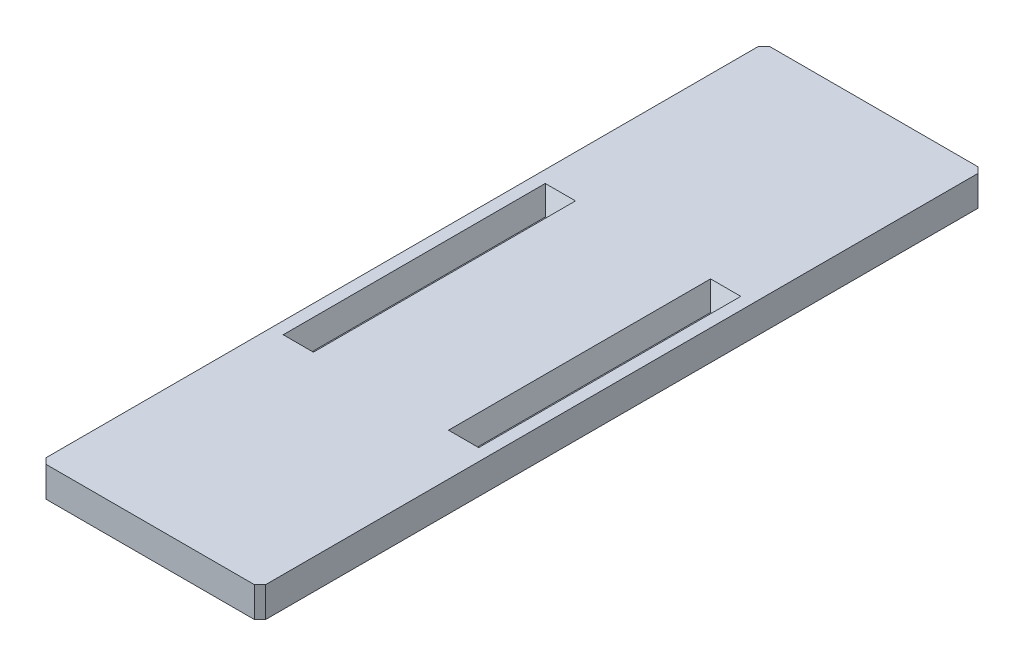
from build123d import *

# Parameters (mm, degrees)
SKETCH_1_W                    = 11.3
SKETCH_1_H                    = 36.3
EXTRUDE_1_DEPTH               = 1.5
CHAMFER_1_SIZE                = 0.4
SKETCH_2_W                    = 1.5
SKETCH_2_H                    = 13
CUT_EXTRUDE_1_DEPTH           = 1
CUT_EXTRUDE_1_DRAFT           = -24
CUT_EXTRUDE_1_PROFILE_2_DEPTH = 1
CUT_EXTRUDE_1_PROFILE_2_DRAFT = -24
CUT_EXTRUDE_2_DEPTH           = 10


with BuildPart() as part:
    # 草图1 → 凸台-拉伸1 (new body)
    with BuildSketch(Plane(origin=(0, 0, 0), x_dir=(1, 0, 0), z_dir=(0, 1, 0))):
        with Locations((5.65, -18.15)):
            Rectangle(SKETCH_1_W, SKETCH_1_H)
    extrude(amount=EXTRUDE_1_DEPTH)

    # 倒角1
    chamfer_1_edges = [part.edges().sort_by_distance(p)[0] for p in [
        (0, 0.75, 0),
        (11.3, 0.75, 0),
        (11.3, 0.75, 36.3),
        (0, 0.75, 36.3),
    ]]
    chamfer(chamfer_1_edges, length=CHAMFER_1_SIZE)


with BuildPart() as cut_extrude_1_tool:
    # 草图2 → 切除-拉伸1 (with draft: the straight prism first)
    with BuildSketch(Plane(origin=(0, 1.5, 0), x_dir=(1, 0, 0), z_dir=(0, 1, 0))):
        with Locations((1.55, -18.15)):
            Rectangle(SKETCH_2_W, SKETCH_2_H)
    extrude(amount=-CUT_EXTRUDE_1_DEPTH)
    # 切除-拉伸1: the draft: its side faces are tilted about the plane it starts from
    cut_extrude_1_sides = [cut_extrude_1_tool.faces().sort_by_distance(p)[0] for p in [
        (0.8, 1, 18.15),
        (1.55, 1, 24.65),
        (2.3, 1, 18.15),
        (1.55, 1, 11.65),
    ]]
    draft(cut_extrude_1_sides, Plane(origin=(0, 1.5, 0), x_dir=(1, 0, 0), z_dir=(0, 1, 0)), CUT_EXTRUDE_1_DRAFT)


with BuildPart() as part_1:
    add(part.part)

    # 切除-拉伸1: cut by cut_extrude_1_tool
    add(cut_extrude_1_tool.part, mode=Mode.SUBTRACT)


with BuildPart() as cut_extrude_1_profile_2_tool:
    # 草图2 → 切除-拉伸1 profile 2 (with draft: the straight prism first)
    with BuildSketch(Plane(origin=(0, 1.5, 0), x_dir=(1, 0, 0), z_dir=(0, 1, 0))):
        with Locations((9.75, -18.15)):
            Rectangle(SKETCH_2_W, SKETCH_2_H)
    extrude(amount=-CUT_EXTRUDE_1_PROFILE_2_DEPTH)
    # 切除-拉伸1 profile 2: the draft: its side faces are tilted about the plane it starts from
    cut_extrude_1_profile_2_sides = [cut_extrude_1_profile_2_tool.faces().sort_by_distance(p)[0] for p in [
        (9.75, 1, 11.65),
        (9, 1, 18.15),
        (9.75, 1, 24.65),
        (10.5, 1, 18.15),
    ]]
    draft(cut_extrude_1_profile_2_sides, Plane(origin=(0, 1.5, 0), x_dir=(1, 0, 0), z_dir=(0, 1, 0)), CUT_EXTRUDE_1_PROFILE_2_DRAFT)


with BuildPart() as part_2:
    add(part_1.part)

    # 切除-拉伸1 profile 2: cut by cut_extrude_1_profile_2_tool
    add(cut_extrude_1_profile_2_tool.part, mode=Mode.SUBTRACT)

    # 草图3 → 切除-拉伸2 (cut)
    with BuildSketch(Plane(origin=(0, 1.5, 0), x_dir=(1, 0, 0), z_dir=(0, 1, 0))):
        Polygon((0, -0.4), (0, -35.9), (0.4, -36.3), (10.9, -36.3), (11.3, -35.9), (11.3, -0.4), (10.9, 0), (0.4, 0), align=None)
        Polygon((0.2, -0.482842712), (0.2, -35.817157288), (0.482842712, -36.1), (10.817157288, -36.1), (11.1, -35.817157288), (11.1, -0.482842712), (10.817157288, -0.2), (0.482842712, -0.2), align=None, mode=Mode.SUBTRACT)
    extrude(amount=-CUT_EXTRUDE_2_DEPTH, mode=Mode.SUBTRACT)


solid = part_2.part
